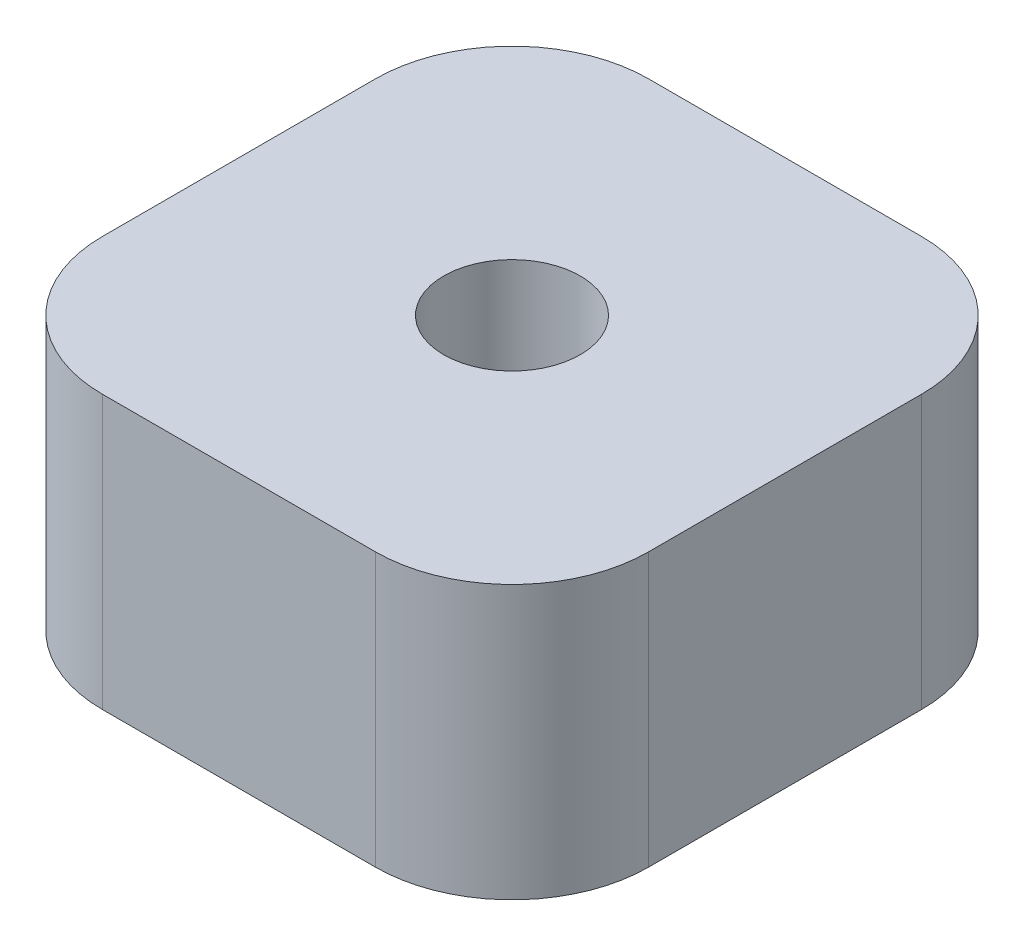
from build123d import *

# Parameters (mm, degrees)
SKETCH1_W           = 25.4
SKETCH1_H           = 25.4
SKETCH1_R           = 3.175
BOSS_EXTRUDE1_DEPTH = 12.7
FILLET1_R           = 6.35


with BuildPart() as part:
    # Sketch1 → Boss-Extrude1 (new body)
    with BuildSketch(Plane(origin=(0, 0, 0), x_dir=(1, 0, 0), z_dir=(0, 1, 0))):
        Rectangle(SKETCH1_W, SKETCH1_H)
        with Locations(Location((0, 0, 0), (0, 0, 270))):
            Circle(SKETCH1_R, mode=Mode.SUBTRACT)
    extrude(amount=BOSS_EXTRUDE1_DEPTH)

    # Fillet1
    fillet1_edges = [part.edges().sort_by_distance(p)[0] for p in [
        (12.7, 6.35, 12.7),
        (-12.7, 6.35, 12.7),
        (-12.7, 6.35, -12.7),
        (12.7, 6.35, -12.7),
    ]]
    fillet(fillet1_edges, radius=FILLET1_R)


solid = part.part
